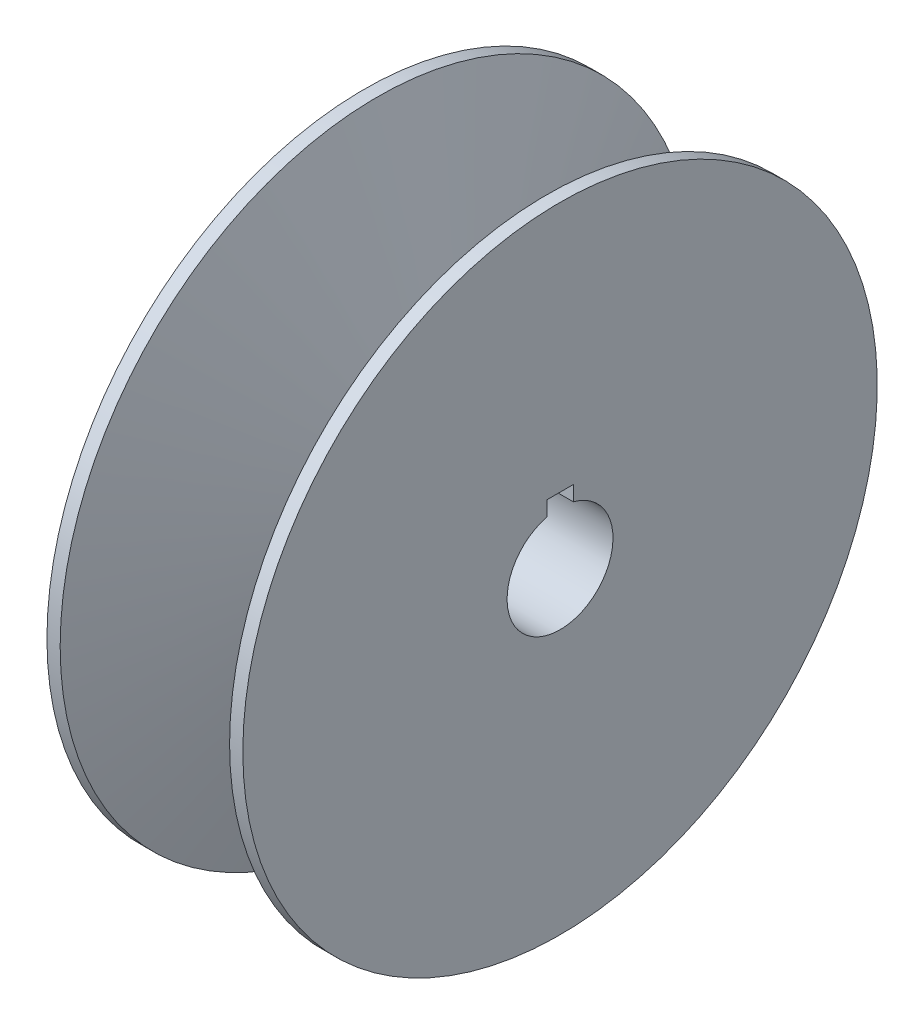
from build123d import *

# Parameters (mm, degrees)
SKETCH1_W               = 3.175
SKETCH1_H               = 69.74205
CUT_EXTRUDE1_DEPTH      = 25.146
CUT_EXTRUDE1_DEPTH_BACK = 108.204
SKETCH2_R               = 6.35


with BuildPart() as part:
    # Sketch1 → Revolve1 (revolve)
    with BuildSketch(Plane.XY, mode=Mode.PRIVATE) as revolve1_sk:
        Polygon((13.238453462, 31.037681507), (0, 76.09205), (0, 6.35), (22.013333333, 6.35), (40.64, 6.35), (40.64, 76.09205), (27.401546538, 31.037681507), align=None)
        with Locations((-1.5875, 41.221025)):
            Rectangle(SKETCH1_W, SKETCH1_H)
        with Locations((42.2275, 41.221025)):
            Rectangle(SKETCH1_W, SKETCH1_H)
    revolve(revolve1_sk.sketch.rotate(Axis((0, 0, 0), (1, 0, 0)), 90), axis=Axis((0, 0, 0), (1, 0, 0)))

    # Sketch2 → Cut-Extrude1 (cut, two sides: drawn at the far end of the back side and taken through both)
    # profile 1 of 4: a face of its own
    with BuildSketch(Plane(origin=(43.815, 0, 0), x_dir=(0, 0, -1), z_dir=(1, 0, 0)).offset(-CUT_EXTRUDE1_DEPTH_BACK)):
        with BuildLine():
            Line((3.175, 12.296722124), (3.175, 9.525))
            Line((3.175, 9.525), (-3.175, 9.525))
            Line((-3.175, 9.525), (-3.175, 12.296722124))
            ThreePointArc((-3.175, 12.296722124), (-7.777129933, -10.040231571), (12.7, 0))
            ThreePointArc((12.7, 0), (10.040231571, 7.777129933), (3.175, 12.296722124))
        make_face()
        Circle(SKETCH2_R, mode=Mode.SUBTRACT)
    # profile 2 of 4: a face of its own
    with BuildSketch(Plane(origin=(43.815, 0, 0), x_dir=(0, 0, -1), z_dir=(1, 0, 0)).offset(-CUT_EXTRUDE1_DEPTH_BACK)):
        with BuildLine():
            Line((-3.175, 9.525), (3.175, 9.525))
            Line((3.175, 9.525), (3.175, 12.296722124))
            ThreePointArc((3.175, 12.296722124), (0, 12.7), (-3.175, 12.296722124))
            Line((-3.175, 12.296722124), (-3.175, 9.525))
        make_face()
    # profile 3 of 4: a face of its own
    with BuildSketch(Plane(origin=(43.815, 0, 0), x_dir=(0, 0, -1), z_dir=(1, 0, 0)).offset(-CUT_EXTRUDE1_DEPTH_BACK)):
        with BuildLine():
            ThreePointArc((-3.175, 12.296722124), (0, 12.7), (3.175, 12.296722124))
            Line((3.175, 12.296722124), (3.175, 15.875))
            Line((3.175, 15.875), (-3.175, 15.875))
            Line((-3.175, 15.875), (-3.175, 12.296722124))
        make_face()
    # profile 4 of 4: a face of its own
    with BuildSketch(Plane(origin=(43.815, 0, 0), x_dir=(0, 0, -1), z_dir=(1, 0, 0)).offset(-CUT_EXTRUDE1_DEPTH_BACK)):
        with BuildLine():
            Line((-3.175, 9.525), (3.175, 9.525))
            Line((3.175, 9.525), (3.175, 12.296722124))
            ThreePointArc((3.175, 12.296722124), (0, 12.7), (-3.175, 12.296722124))
            Line((-3.175, 12.296722124), (-3.175, 9.525))
        make_face()
    extrude(amount=CUT_EXTRUDE1_DEPTH + CUT_EXTRUDE1_DEPTH_BACK, mode=Mode.SUBTRACT)


solid = part.part
